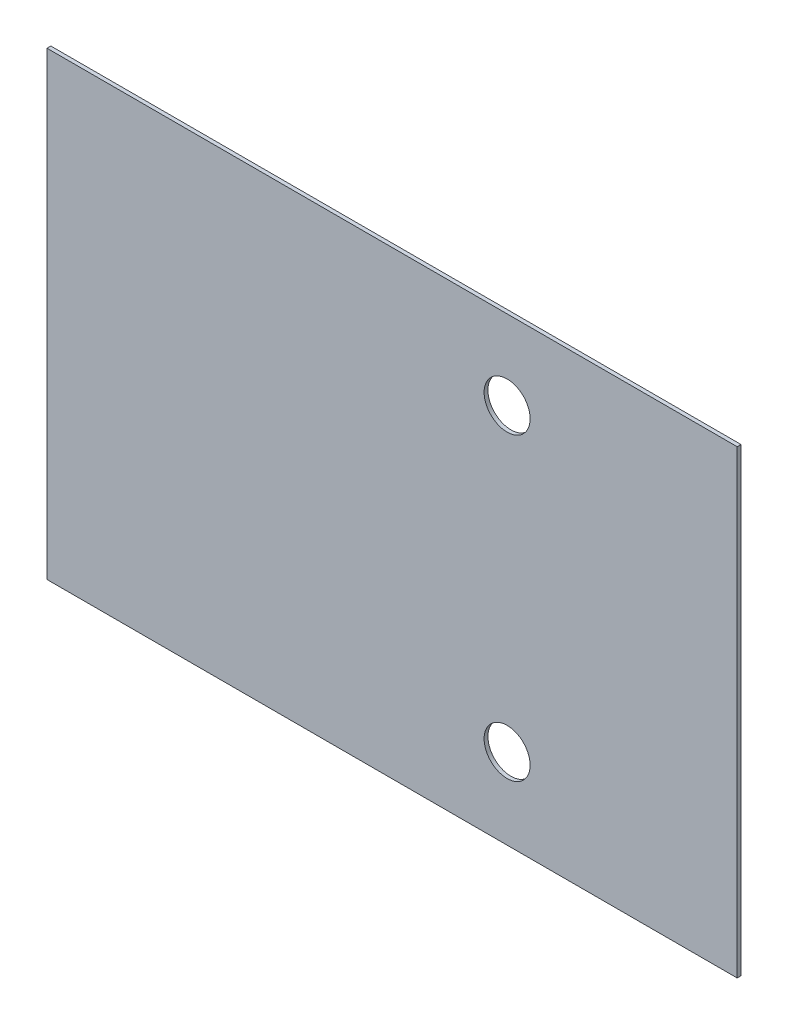
from build123d import *

# Parameters (mm, degrees)
SKETCH1_W           = 900
SKETCH1_H           = 600
BOSS_EXTRUDE1_DEPTH = 5
SKETCH2_R           = 30
CUT_EXTRUDE2_DEPTH  = 10
SKETCH3_R           = 30
CUT_EXTRUDE3_DEPTH  = 10


with BuildPart() as part:
    # Sketch1 → Boss-Extrude1 (new body)
    with BuildSketch(Plane.XY):
        with Locations((25.545851528, 338.64628821)):
            Rectangle(SKETCH1_W, SKETCH1_H)
    extrude(amount=BOSS_EXTRUDE1_DEPTH)

    # Sketch2 → Cut-Extrude2 (cut)
    with BuildSketch(Plane(origin=(0, 0, 0), x_dir=(-1, 0, 0), z_dir=(0, 0, -1))):
        with Locations((-175.545851528, 535.128567936)):
            Circle(SKETCH2_R)
    extrude(amount=-CUT_EXTRUDE2_DEPTH, mode=Mode.SUBTRACT)

    # Sketch3 → Cut-Extrude3 (cut)
    with BuildSketch(Plane(origin=(0, 0, 0), x_dir=(-1, 0, 0), z_dir=(0, 0, -1))):
        with Locations((-175.545851528, 143.938114846)):
            Circle(SKETCH3_R)
    extrude(amount=-CUT_EXTRUDE3_DEPTH, mode=Mode.SUBTRACT)


solid = part.part
